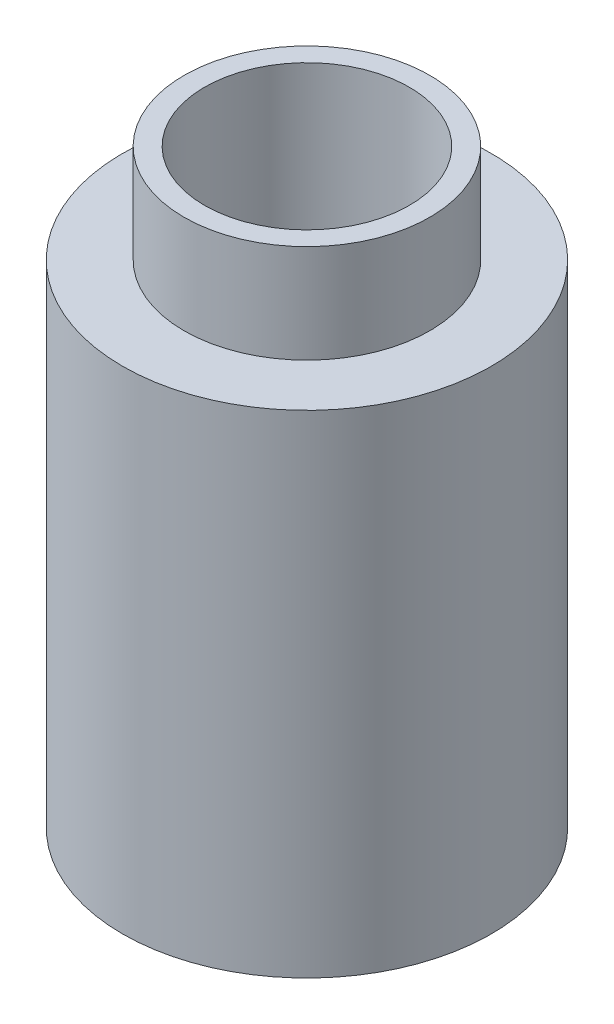
from build123d import *

# Parameters (mm, degrees)
SKETCH_1_R      = 2.25
SKETCH_1_R_2    = 1.25
EXTRUDE_1_DEPTH = 6
SKETCH_2_R      = 1.5
SKETCH_2_R_2    = 1.25
EXTRUDE_2_DEPTH = 1.2


with BuildPart() as part:
    # 草图1 → 凸台-拉伸1 (new body)
    with BuildSketch(Plane(origin=(0, 0, 0), x_dir=(1, 0, 0), z_dir=(0, 1, 0))):
        with Locations(Location((0, 0, 0), (0, 0, 270))):
            Circle(SKETCH_1_R)
        with Locations(Location((0, 0, 0), (0, 0, 270))):
            Circle(SKETCH_1_R_2, mode=Mode.SUBTRACT)
    extrude(amount=EXTRUDE_1_DEPTH)

    # 草图2 → 凸台-拉伸2 (add)
    with BuildSketch(Plane(origin=(0, 6, 0), x_dir=(1, 0, 0), z_dir=(0, 1, 0))):
        with Locations(Location((0, 0, 0), (0, 0, 270))):
            Circle(SKETCH_2_R)
        with Locations(Location((0, 0, 0), (0, 0, 270))):
            Circle(SKETCH_2_R_2, mode=Mode.SUBTRACT)
    extrude(amount=EXTRUDE_2_DEPTH)


solid = part.part
